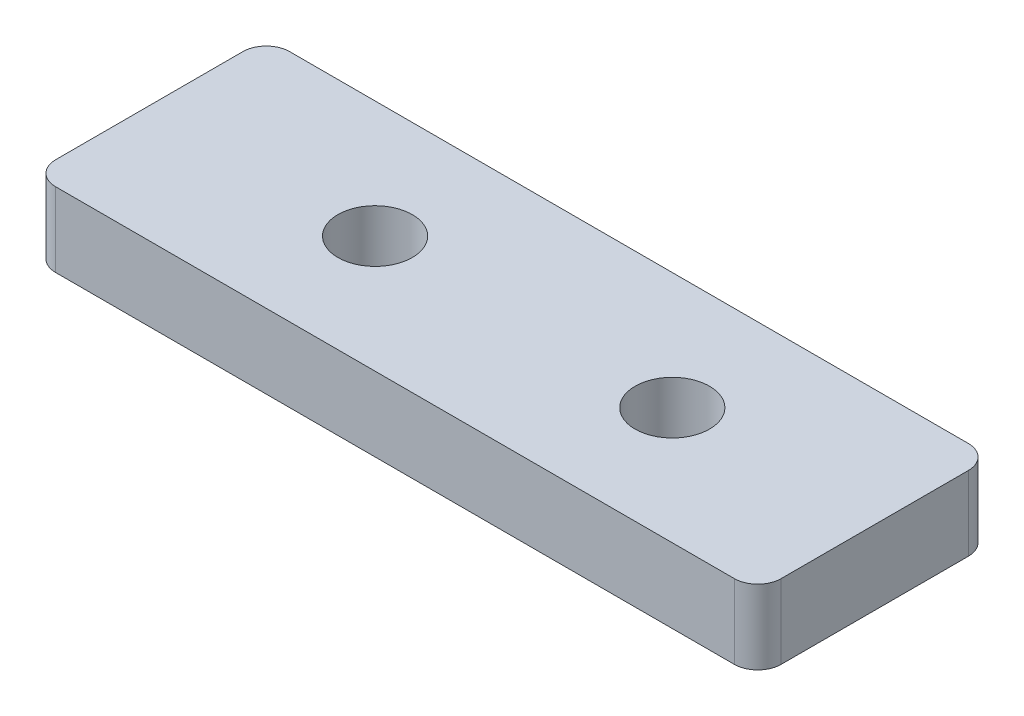
from build123d import *

# Parameters (mm, degrees)
SKETCH1_W           = 20
SKETCH1_H           = 10
SKETCH1_R           = 1.59
SKETCH1_W_2         = 6
SKETCH1_W_3         = 5
BOSS_EXTRUDE1_DEPTH = 3.175
FILLET1_R           = 1


with BuildPart() as part:
    # Sketch1 → Boss-Extrude1 (new body)
    # profile 1 of 3: a face of its own
    with BuildSketch(Plane(origin=(0, 0, 0), x_dir=(1, 0, 0), z_dir=(0, 1, 0))):
        with Locations((6.35, 0)):
            Rectangle(SKETCH1_W, SKETCH1_H)
        with Locations(Location((0, 0, 0), (0, 0, 270))):
            Circle(SKETCH1_R, mode=Mode.SUBTRACT)
        with Locations(Location((12.7, 0, 0), (0, 0, 270))):
            Circle(SKETCH1_R, mode=Mode.SUBTRACT)
    # profile 2 of 3: a face of its own
    with BuildSketch(Plane(origin=(0, 0, 0), x_dir=(1, 0, 0), z_dir=(0, 1, 0))):
        with Locations((-6.65, 0)):
            Rectangle(SKETCH1_W_2, SKETCH1_H)
    # profile 3 of 3: a face of its own
    with BuildSketch(Plane(origin=(0, 0, 0), x_dir=(1, 0, 0), z_dir=(0, 1, 0))):
        with Locations((18.85, 0)):
            Rectangle(SKETCH1_W_3, SKETCH1_H)
    extrude(amount=BOSS_EXTRUDE1_DEPTH)

    # Fillet1
    fillet1_edges = [part.edges().sort_by_distance(p)[0] for p in [
        (-9.65, 1.5875, 5),
        (-9.65, 1.5875, -5),
        (21.35, 1.5875, -5),
        (21.35, 1.5875, 5),
    ]]
    fillet(fillet1_edges, radius=FILLET1_R)


solid = part.part
